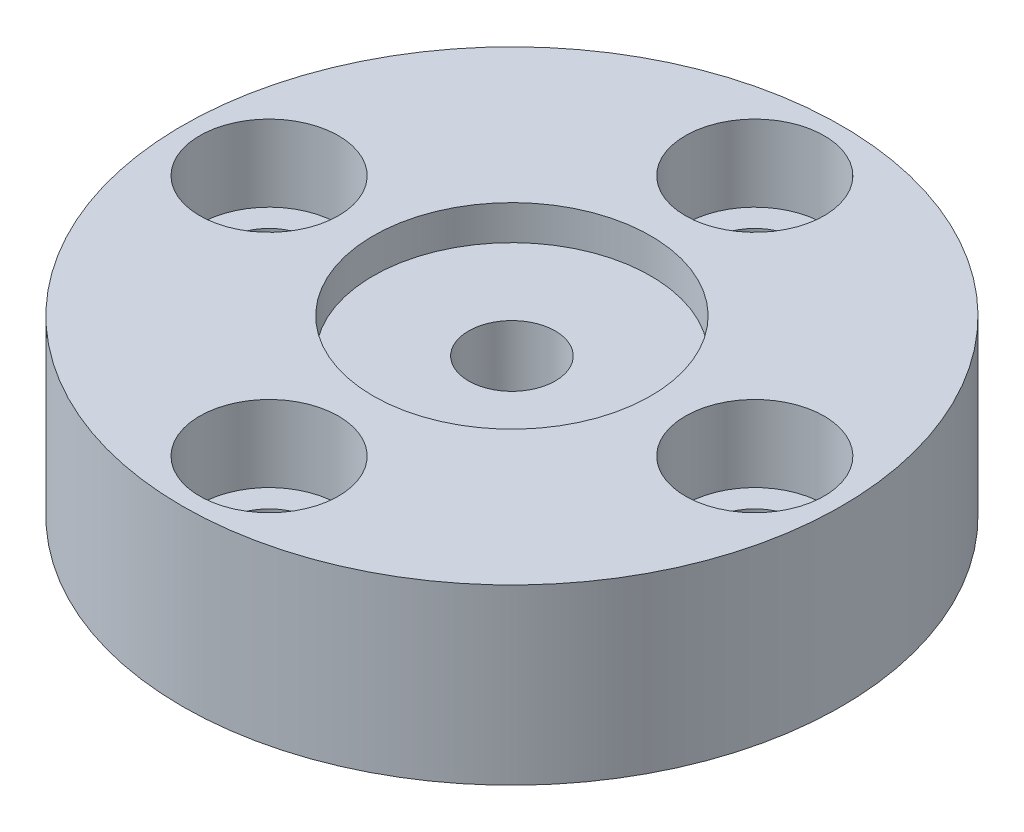
from build123d import *

# Parameters (mm, degrees)
SKETCH_1_R               = 19
EXTRUDE_1_DEPTH          = 10
SKETCH_2_R               = 8
CUT_EXTRUDE_1_DEPTH      = 2
SKETCH_3_R               = 6
CUT_EXTRUDE_2_DEPTH      = 3
SKETCH_4_R               = 2.5
CUT_EXTRUDE_3_DEPTH      = 16
SKETCH_5_R               = 4
CUT_EXTRUDE_4_DEPTH      = 4.4
SKETCH_6_R               = 2.5
CUT_EXTRUDE_5_DEPTH      = 28.447404249
PATTERN_CIRCULAR_1_COUNT = 4


with BuildPart() as part:
    # 草图1 → 凸台-拉伸1 (new body)
    with BuildSketch(Plane(origin=(0, 0, 0), x_dir=(1, 0, 0), z_dir=(0, 1, 0))):
        with Locations(Location((0, 0, 0), (0, 0, 270))):
            Circle(SKETCH_1_R)
    extrude(amount=EXTRUDE_1_DEPTH)

    # 草图2 → 切除-拉伸1 (cut)
    with BuildSketch(Plane(origin=(0, 10, 0), x_dir=(1, 0, 0), z_dir=(0, 1, 0))):
        with Locations(Location((0, 0, 0), (0, 0, 270))):
            Circle(SKETCH_2_R)
    extrude(amount=-CUT_EXTRUDE_1_DEPTH, mode=Mode.SUBTRACT)

    # 草图3 → 切除-拉伸2 (cut)
    with BuildSketch(Plane.XZ):
        with Locations(Location((0, 0, 0), (0, 0, 270))):
            Circle(SKETCH_3_R)
    extrude(amount=-CUT_EXTRUDE_2_DEPTH, mode=Mode.SUBTRACT)

    # 草图4 → 切除-拉伸3 (cut)
    with BuildSketch(Plane.XZ.offset(-3)):
        with Locations(Location((0, 0, 0), (0, 0, 270))):
            Circle(SKETCH_4_R)
    extrude(amount=-CUT_EXTRUDE_3_DEPTH, mode=Mode.SUBTRACT)

    # 草图5 → 切除-拉伸4 (cut)
    with BuildSketch(Plane(origin=(0, 10, 0), x_dir=(1, 0, 0), z_dir=(0, 1, 0))):
        with Locations(Location((0, 14, 0), (0, 0, 270))):
            Circle(SKETCH_5_R)
    cut_extrude_4 = extrude(amount=-CUT_EXTRUDE_4_DEPTH, mode=Mode.SUBTRACT)

    # 草图6 → 切除-拉伸5 (cut, through all)
    with BuildSketch(Plane(origin=(0, 5.6, 0), x_dir=(1, 0, 0), z_dir=(0, 1, 0))):
        with Locations(Location((0, 14, 0), (0, 0, 270))):
            Circle(SKETCH_6_R)
    cut_extrude_5 = extrude(amount=-CUT_EXTRUDE_5_DEPTH, mode=Mode.SUBTRACT)

    # 阵列(圆周)1: 切除-拉伸4, 切除-拉伸5 ×4 about axis
    pattern_circular_1_axis = Axis((0, 0, 0), (0, 1, 0))
    add([cut_extrude_4.rotate(pattern_circular_1_axis, i * 360 / PATTERN_CIRCULAR_1_COUNT) for i in range(1, PATTERN_CIRCULAR_1_COUNT)], mode=Mode.SUBTRACT)
    add([cut_extrude_5.rotate(pattern_circular_1_axis, i * 360 / PATTERN_CIRCULAR_1_COUNT) for i in range(1, PATTERN_CIRCULAR_1_COUNT)], mode=Mode.SUBTRACT)


solid = part.part
